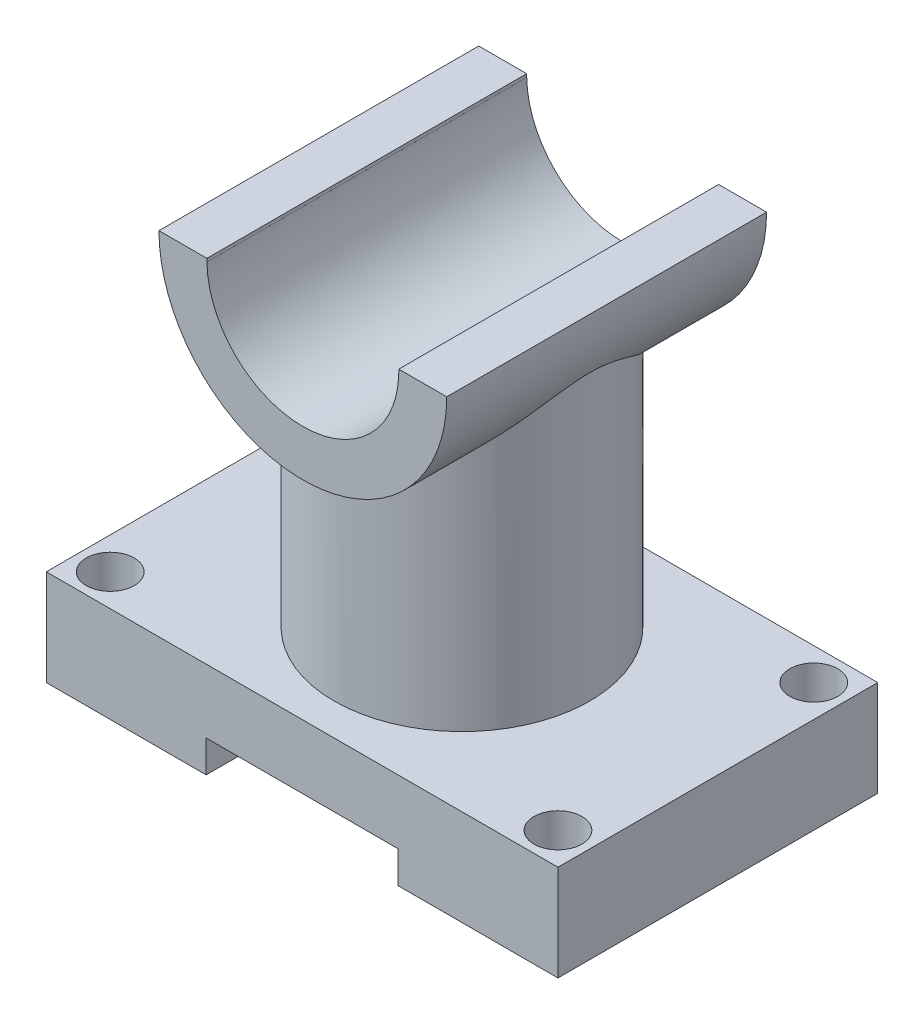
from build123d import *

# Parameters (mm, degrees)
SKETCH1_W           = 160
SKETCH1_H           = 100
BOSS_EXTRUDE1_DEPTH = 30
SKETCH2_R           = 40
BOSS_EXTRUDE2_DEPTH = 110
BOSS_EXTRUDE3_DEPTH = 100
CUT_EXTRUDE1_DEPTH  = 100
SKETCH6_W           = 60
SKETCH6_H           = 100
CUT_EXTRUDE2_DEPTH  = 1
SKETCH7_W           = 60
SKETCH7_H           = 10
CUT_EXTRUDE3_DEPTH  = 100
SKETCH8_R           = 7.5
CUT_EXTRUDE4_DEPTH  = 100


with BuildPart() as part:
    # Sketch1 → Boss-Extrude1 (new body)
    with BuildSketch(Plane(origin=(0, 0, 0), x_dir=(1, 0, 0), z_dir=(0, 1, 0))):
        with Locations((7.145359019, 50)):
            Rectangle(SKETCH1_W, SKETCH1_H)
    extrude(amount=-BOSS_EXTRUDE1_DEPTH)

    # Sketch2 → Boss-Extrude2 (add)
    with BuildSketch(Plane(origin=(0, 0, 0), x_dir=(1, 0, 0), z_dir=(0, 1, 0))):
        with Locations(Location((7.145359019, 50, 0), (0, 0, 270))):
            Circle(SKETCH2_R)
    extrude(amount=BOSS_EXTRUDE2_DEPTH)

    # Sketch3 → Boss-Extrude3 (add)
    with BuildSketch(Plane.XY):
        with BuildLine():
            Line((-37.620353567, 110), (52.379646433, 110))
            ThreePointArc((52.379646433, 110), (7.379646433, 65), (-37.620353567, 110))
        make_face()
        with BuildLine():
            Line((-22.620353567, 109.466218226), (37.379646433, 109.466218226))
            ThreePointArc((37.379646433, 109.466218226), (7.379646433, 79.466218226), (-22.620353567, 109.466218226))
        make_face(mode=Mode.SUBTRACT)
    extrude(amount=-BOSS_EXTRUDE3_DEPTH)

    # Sketch4 → Cut-Extrude1 (cut)
    with BuildSketch(Plane.XY):
        with BuildLine():
            Line((-22.620353567, 109.466218226), (37.379646433, 109.466218226))
            ThreePointArc((37.379646433, 109.466218226), (7.379646433, 79.466218226), (-22.620353567, 109.466218226))
        make_face()
    extrude(amount=-CUT_EXTRUDE1_DEPTH, mode=Mode.SUBTRACT)

    # Sketch6 → Cut-Extrude2 (cut)
    with BuildSketch(Plane(origin=(0, 110, 0), x_dir=(1, 0, 0), z_dir=(0, 1, 0))):
        with Locations((7.379646433, 50)):
            Rectangle(SKETCH6_W, SKETCH6_H)
    extrude(amount=-CUT_EXTRUDE2_DEPTH, mode=Mode.SUBTRACT)

    # Sketch7 → Cut-Extrude3 (cut)
    with BuildSketch(Plane.XY):
        with Locations((7.145359019, -25)):
            Rectangle(SKETCH7_W, SKETCH7_H)
    extrude(amount=-CUT_EXTRUDE3_DEPTH, mode=Mode.SUBTRACT)

    # Sketch8 → Cut-Extrude4 (cut)
    with BuildSketch(Plane(origin=(0, 0, 0), x_dir=(1, 0, 0), z_dir=(0, 1, 0))):
        with Locations(Location((77.145359019, 90, 0), (0, 0, 270))):
            Circle(SKETCH8_R)
        with Locations(Location((-62.854640981, 90, 0), (0, 0, 270))):
            Circle(SKETCH8_R)
        with Locations(Location((-62.854640981, 10, 0), (0, 0, 270))):
            Circle(SKETCH8_R)
        with Locations(Location((77.145359019, 10, 0), (0, 0, 270))):
            Circle(SKETCH8_R)
    extrude(amount=-CUT_EXTRUDE4_DEPTH, mode=Mode.SUBTRACT)


solid = part.part
